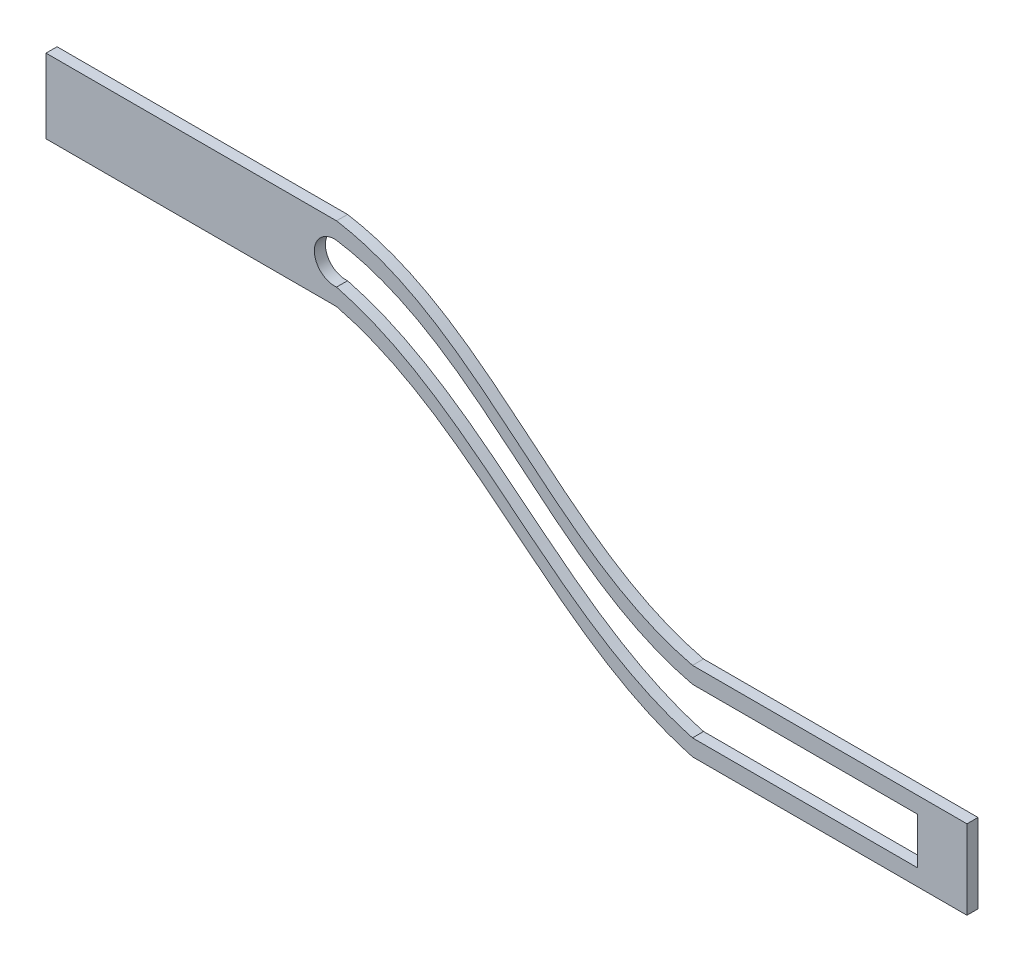
from build123d import *

# Parameters (mm, degrees)
BOSS_EXTRUDE1_DEPTH = 3.8


with BuildPart() as part:
    # Sketch1 → Boss-Extrude1 (new body)
    with BuildSketch(Plane.XY):
        with BuildLine():
            Line((-183.434400527, 71.218162808), (-283.388111119, 71.218162808))
            Line((-283.388111119, 71.218162808), (-283.388111119, 45.671242369))
            Line((-283.388111119, 45.671242369), (-183.434400527, 45.671242369))
            add(Edge.make_bspline(
                [(-183.434400527, 45.671242369), (-135.823073525, 33.710571784), (-108.755954443, -14.312606995), (-60.948326307, -27.25367588)],
                knots=[0, 0, 0, 0, 1, 1, 1, 1], degree=3))
            Line((-60.948326307, -27.25367588), (33.485476227, -27.25367588))
            Line((33.485476227, -27.25367588), (33.485476227, 0))
            Line((33.485476227, 0), (-60.948326307, 0))
            add(Edge.make_bspline(
                [(-183.434400527, 71.218162808), (-134.596760432, 63.241960011), (-109.105838052, 11.434490967), (-60.948326307, 0)],
                knots=[0, 0, 0, 0, 1, 1, 1, 1], degree=3))
        make_face()
        with BuildLine():
            Line((16.41594826, -5.645404289), (-60.948326307, -5.645404289))
            add(Edge.make_bspline(
                [(-183.434400527, 65.418162808), (-134.494216102, 57.813087075), (-109.135947228, 5.64820533), (-60.948326307, -5.645404289)],
                knots=[0, 0, 0, 0, 1, 1, 1, 1], degree=3))
            ThreePointArc((-183.434400527, 65.418162808), (-191.043377182, 58.444702588), (-183.434400527, 51.471242369))
            add(Edge.make_bspline(
                [(-183.434400527, 51.471242369), (-135.942087972, 39.160056631), (-108.723006617, -8.535375407), (-60.948326307, -21.608271591)],
                knots=[0, 0, 0, 0, 1, 1, 1, 1], degree=3))
            Line((-60.948326307, -21.608271591), (16.41594826, -21.608271591))
            Line((16.41594826, -21.608271591), (16.41594826, -5.645404289))
        make_face(mode=Mode.SUBTRACT)
    extrude(amount=BOSS_EXTRUDE1_DEPTH)


solid = part.part
